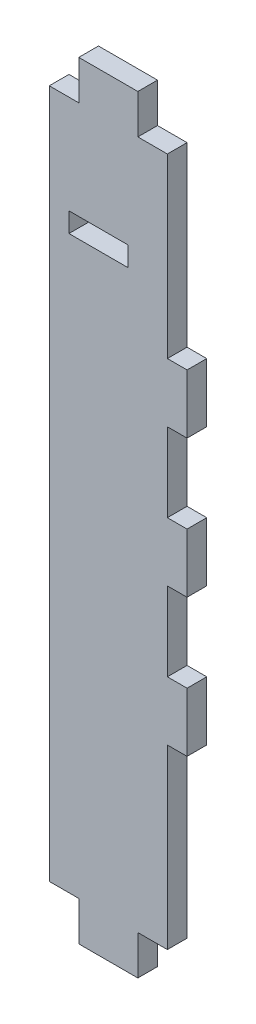
from build123d import *

# Parameters (mm, degrees)
SKETCH1_W           = 15
SKETCH1_H           = 5
BOSS_EXTRUDE1_DEPTH = 2.5


with BuildPart() as part:
    # Sketch1 → Boss-Extrude1 (new, symmetric)
    with BuildSketch(Plane.XY):
        Polygon((430, 300), (430, 255), (422.5, 255), (422.5, 245), (407.5, 245), (407.5, 255), (400, 255), (400, 430), (407.5, 430), (407.5, 440), (422.5, 440), (422.5, 430), (430, 430), (430, 385), (435, 385), (435, 370), (430, 370), (430, 350), (435, 350), (435, 335), (430, 335), (430, 315), (435, 315), (435, 300), align=None)
        with Locations((412.5, 402.5)):
            Rectangle(SKETCH1_W, SKETCH1_H, mode=Mode.SUBTRACT)
    extrude(amount=BOSS_EXTRUDE1_DEPTH, both=True)


solid = part.part
